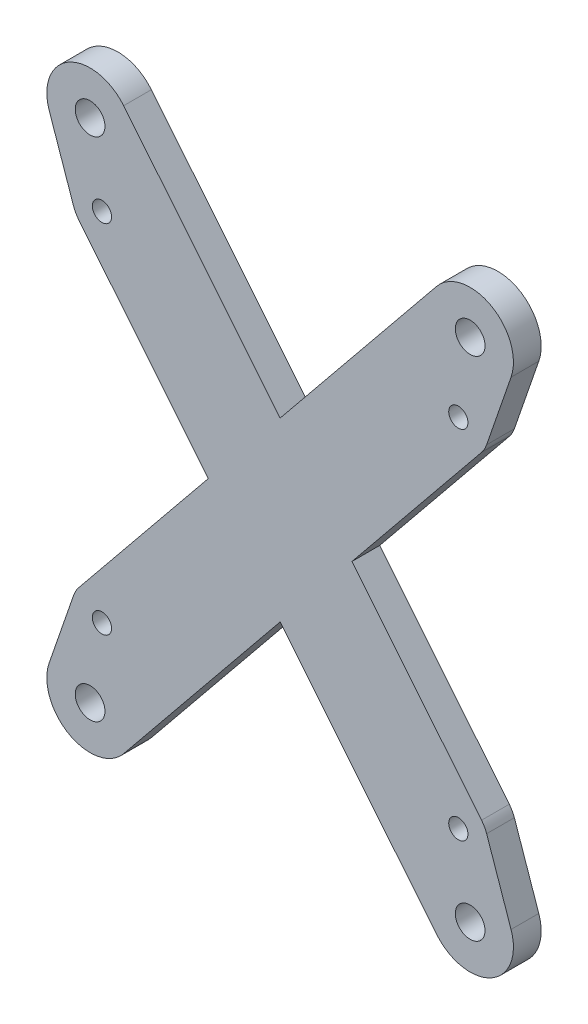
from build123d import *

# Parameters (mm, degrees)
SKETCH1_R           = 1.7018
SKETCH1_R_2         = 1.1
BOSS_EXTRUDE1_DEPTH = 3.175


with BuildPart() as part:
    # Sketch1 → Boss-Extrude1 (new body)
    with BuildSketch(Plane.XY):
        with BuildLine():
            Line((-23.059785094, 18.235838692), (-8.221884337, 0))
            Line((-8.221884337, 0), (-23.059785094, -18.235838692))
            ThreePointArc((-23.059785094, -18.235838692), (-23.396423143, -18.732811969), (-23.641240585, -19.280874041))
            Line((-23.641240585, -19.280874041), (-26.436877512, -27.377570282))
            ThreePointArc((-26.436877512, -27.377570282), (-24.163274934, -33.322252318), (-17.913202642, -32.120125223))
            Line((-17.913202642, -32.120125223), (0, -10.104728355))
            Line((0, -10.104728355), (17.913202642, -32.120125223))
            ThreePointArc((17.913202642, -32.120125223), (24.163274934, -33.322252318), (26.436877512, -27.377570282))
            Line((26.436877512, -27.377570282), (23.641240585, -19.280874041))
            ThreePointArc((23.641240585, -19.280874041), (23.396423143, -18.732811969), (23.059785094, -18.235838692))
            Line((23.059785094, -18.235838692), (8.221884337, 0))
            Line((8.221884337, 0), (23.059785094, 18.235838692))
            ThreePointArc((23.059785094, 18.235838692), (23.396423143, 18.732811969), (23.641240585, 19.280874041))
            Line((23.641240585, 19.280874041), (26.436877512, 27.377570282))
            ThreePointArc((26.436877512, 27.377570282), (24.163274934, 33.322252318), (17.913202642, 32.120125223))
            Line((17.913202642, 32.120125223), (0, 10.104728355))
            Line((0, 10.104728355), (-17.913202642, 32.120125223))
            ThreePointArc((-17.913202642, 32.120125223), (-24.163274934, 33.322252318), (-26.436877512, 27.377570282))
            Line((-26.436877512, 27.377570282), (-23.641240585, 19.280874041))
            ThreePointArc((-23.641240585, 19.280874041), (-23.396423143, 18.732811969), (-23.059785094, 18.235838692))
        make_face()
        with Locations((21.7551, 28.9941)):
            Circle(SKETCH1_R, mode=Mode.SUBTRACT)
        with Locations((-21.7551, 28.9941)):
            Circle(SKETCH1_R, mode=Mode.SUBTRACT)
        with Locations((-21.7551, -28.9941)):
            Circle(SKETCH1_R, mode=Mode.SUBTRACT)
        with Locations((21.7551, -28.9941)):
            Circle(SKETCH1_R, mode=Mode.SUBTRACT)
        with Locations((20.40001, 20.40001)):
            Circle(SKETCH1_R_2, mode=Mode.SUBTRACT)
        with Locations((-20.40001, 20.40001)):
            Circle(SKETCH1_R_2, mode=Mode.SUBTRACT)
        with Locations((-20.40001, -20.40001)):
            Circle(SKETCH1_R_2, mode=Mode.SUBTRACT)
        with Locations((20.40001, -20.40001)):
            Circle(SKETCH1_R_2, mode=Mode.SUBTRACT)
    extrude(amount=BOSS_EXTRUDE1_DEPTH)


solid = part.part
